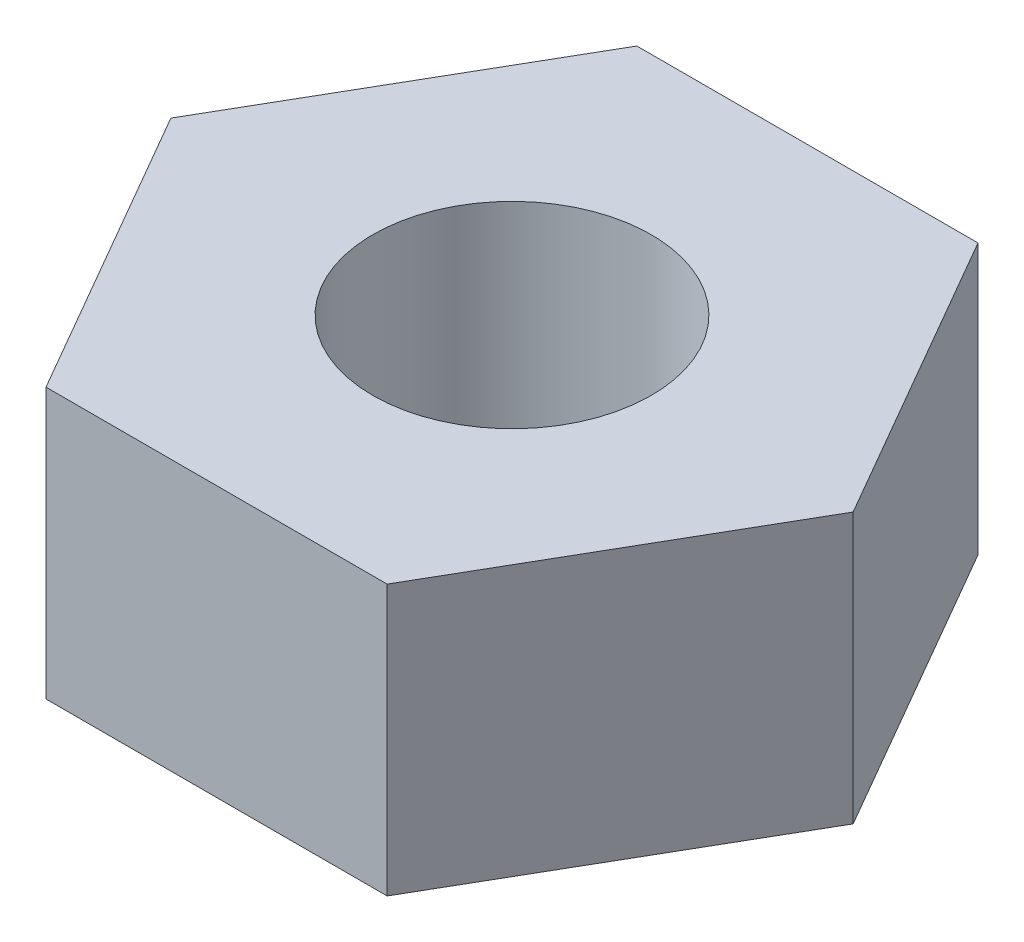
from build123d import *

# Parameters (mm, degrees)
CROQUIS1_R              = 1.65
SALIENTE_EXTRUIR1_DEPTH = 3.2


with BuildPart() as part:
    # Croquis1 → Saliente-Extruir1 (new body)
    with BuildSketch(Plane(origin=(0, 0, 0), x_dir=(1, 0, 0), z_dir=(0, 1, 0))):
        Polygon((-2.020725942, 3.5), (-4.041451884, 0), (-2.020725942, -3.5), (2.020725942, -3.5), (4.041451884, 0), (2.020725942, 3.5), align=None)
        with Locations(Location((0, 0, 0), (0, 0, 270))):
            Circle(CROQUIS1_R, mode=Mode.SUBTRACT)
    extrude(amount=SALIENTE_EXTRUIR1_DEPTH)


solid = part.part
